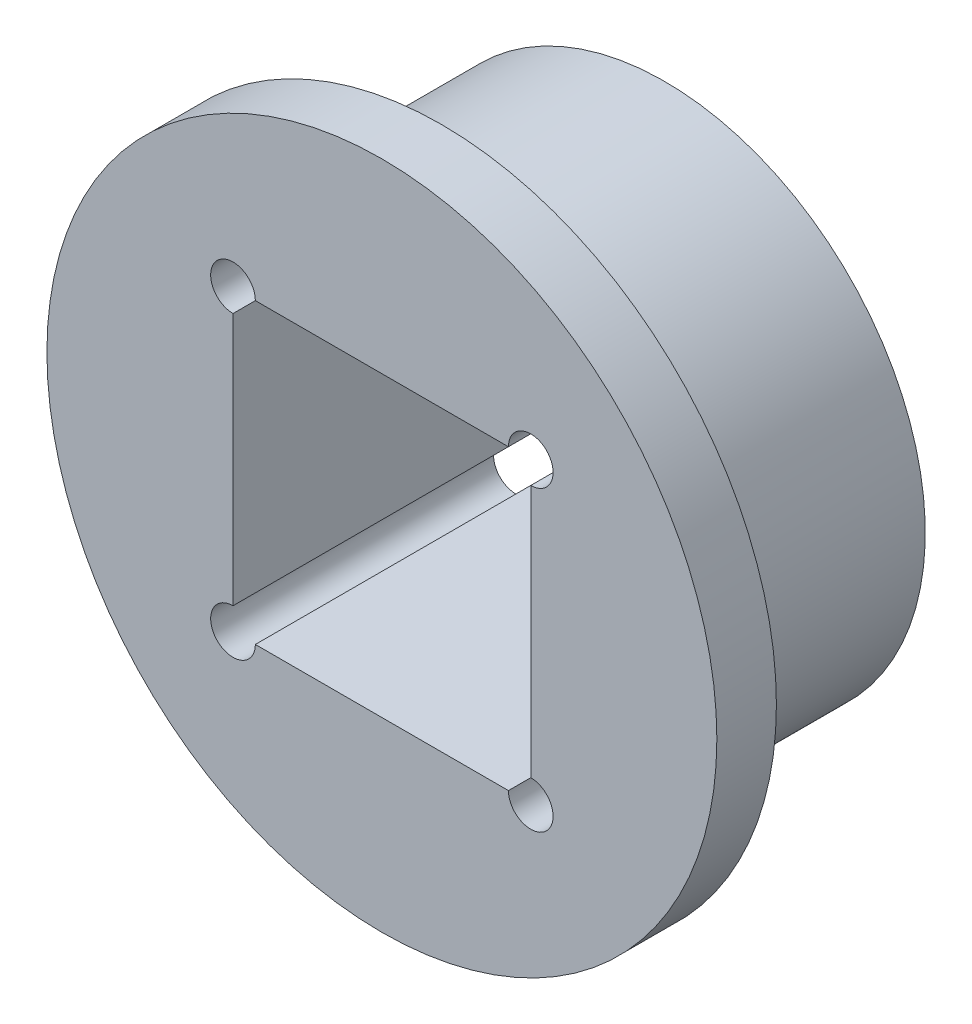
from build123d import *

# Parameters (mm, degrees)
SKETCH_1_R          = 22.5
EXTRUDE_1_DEPTH     = 4
SKETCH_2_R          = 17.5
EXTRUDE_2_DEPTH     = 15
SKETCH_3_R          = 1.5
SKETCH_3_W          = 20
SKETCH_3_H          = 20
CUT_EXTRUDE_1_DEPTH = 38.06076092


with BuildPart() as part:
    # 草图1 → 凸台-拉伸1 (new body)
    with BuildSketch(Plane.XY):
        Circle(SKETCH_1_R)
    extrude(amount=EXTRUDE_1_DEPTH)

    # 草图2 → 凸台-拉伸2 (add)
    with BuildSketch(Plane(origin=(0, 0, 0), x_dir=(-1, 0, 0), z_dir=(0, 0, -1))):
        Circle(SKETCH_2_R)
    extrude(amount=EXTRUDE_2_DEPTH)

    # 草图3 → 切除-拉伸1 (cut, through all)
    with BuildSketch(Plane.XY.offset(4)):
        with BuildLine():
            ThreePointArc((-8.5, -10), (-8.939339828, -8.939339828), (-10, -8.5))
            Line((-10, -8.5), (-10, -10))
            Line((-10, -10), (-8.5, -10))
        make_face()
        with BuildLine():
            Line((-10, -10), (-10, -8.5))
            ThreePointArc((-10, -8.5), (-11.060660172, -11.060660172), (-8.5, -10))
            Line((-8.5, -10), (-10, -10))
        make_face()
        with Locations((-10, -10)):
            Circle(SKETCH_3_R)
        with Locations((10, -10)):
            Circle(SKETCH_3_R)
        with Locations((10, 10)):
            Circle(SKETCH_3_R)
        with Locations((-10, 10)):
            Circle(SKETCH_3_R)
        Rectangle(SKETCH_3_W, SKETCH_3_H)
        with BuildLine():
            ThreePointArc((11.5, -10), (11.060660172, -8.939339828), (10, -8.5))
            Line((10, -8.5), (10, -10))
            Line((10, -10), (8.5, -10))
            ThreePointArc((8.5, -10), (10, -11.5), (11.5, -10))
        make_face()
        with BuildLine():
            Line((10, -10), (10, -8.5))
            ThreePointArc((10, -8.5), (8.939339828, -8.939339828), (8.5, -10))
            Line((8.5, -10), (10, -10))
        make_face()
        with BuildLine():
            ThreePointArc((11.5, 10), (10, 11.5), (8.5, 10))
            Line((8.5, 10), (10, 10))
            Line((10, 10), (10, 8.5))
            ThreePointArc((10, 8.5), (11.060660172, 8.939339828), (11.5, 10))
        make_face()
        with BuildLine():
            Line((10, 10), (8.5, 10))
            ThreePointArc((8.5, 10), (8.939339828, 8.939339828), (10, 8.5))
            Line((10, 8.5), (10, 10))
        make_face()
        with BuildLine():
            Line((-10, 8.5), (-10, 10))
            Line((-10, 10), (-8.5, 10))
            ThreePointArc((-8.5, 10), (-11.060660172, 11.060660172), (-10, 8.5))
        make_face()
        with BuildLine():
            Line((-8.5, 10), (-10, 10))
            Line((-10, 10), (-10, 8.5))
            ThreePointArc((-10, 8.5), (-8.939339828, 8.939339828), (-8.5, 10))
        make_face()
    extrude(amount=-CUT_EXTRUDE_1_DEPTH, mode=Mode.SUBTRACT)


solid = part.part
